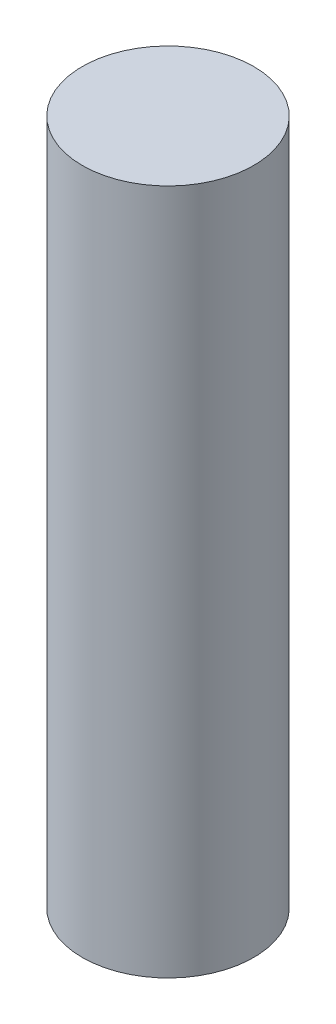
from build123d import *

# Parameters (mm, degrees)
SKETCH_1_R      = 1.5
EXTRUDE_1_DEPTH = 12


with BuildPart() as part:
    # 草图1 → 凸台-拉伸1 (new body)
    with BuildSketch(Plane(origin=(0, 0, 0), x_dir=(1, 0, 0), z_dir=(0, 1, 0))):
        with Locations(Location((0, 0, 0), (0, 0, 270))):
            Circle(SKETCH_1_R)
    extrude(amount=EXTRUDE_1_DEPTH)


solid = part.part
